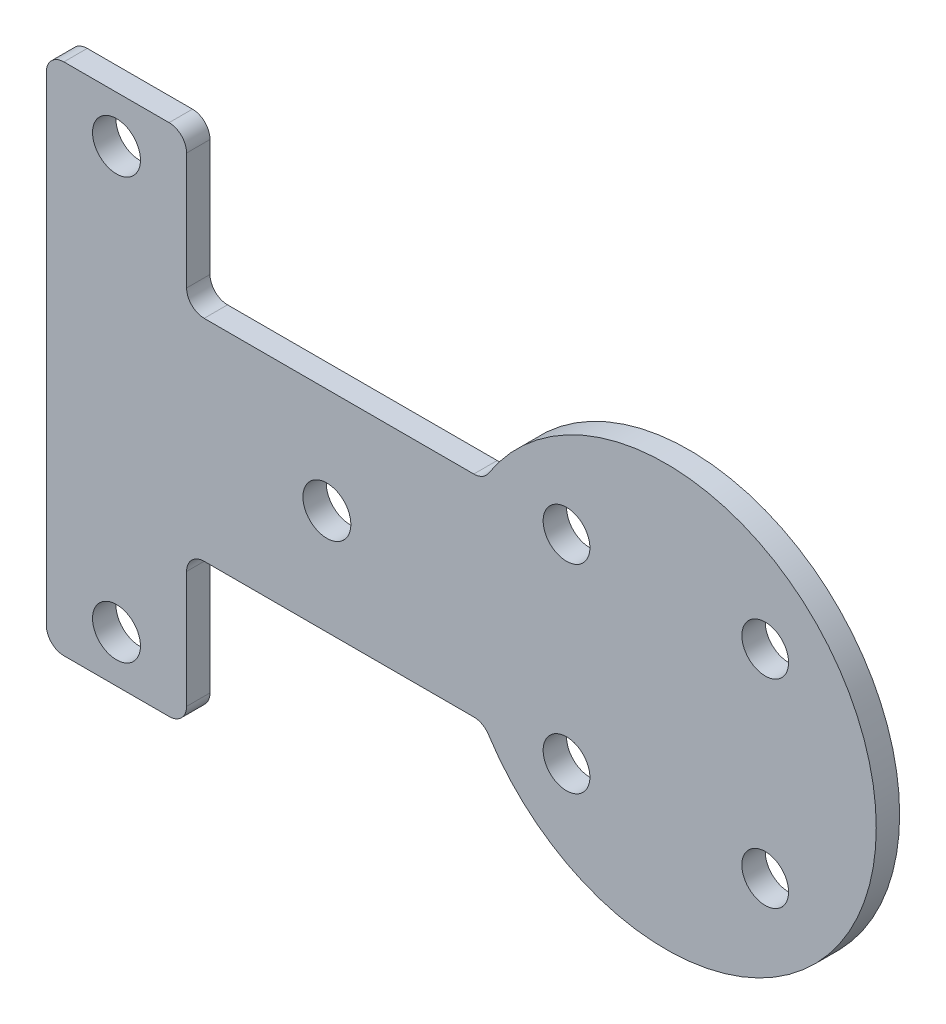
from build123d import *

# Parameters (mm, degrees)
SKETCH_1_R      = 2.05
SKETCH_1_R_2    = 2
EXTRUDE_1_DEPTH = 2
FILLET_1_R      = 1.5


with BuildPart() as part:
    # 草图1 → 凸台-拉伸1 (new body)
    with BuildSketch(Plane.XY):
        with BuildLine():
            Line((-42.723571429, -13.369911995), (-17.312028697, -13.369911995))
            ThreePointArc((-17.312028697, -13.369911995), (16.276428571, -4.369911995), (-17.312028697, 4.630088005))
            Line((-17.312028697, 4.630088005), (-42.723571429, 4.630088005))
            Line((-42.723571429, 4.630088005), (-42.723571429, 17.630088005))
            Line((-42.723571429, 17.630088005), (-54.723571429, 17.630088005))
            Line((-54.723571429, 17.630088005), (-54.723571429, -26.369911995))
            Line((-54.723571429, -26.369911995), (-42.723571429, -26.369911995))
            Line((-42.723571429, -26.369911995), (-42.723571429, -13.369911995))
        make_face()
        with Locations((-30.723571429, -4.369911995)):
            Circle(SKETCH_1_R, mode=Mode.SUBTRACT)
        with Locations((-48.723571429, 13.630088005)):
            Circle(SKETCH_1_R, mode=Mode.SUBTRACT)
        with Locations((-48.723571429, -22.369911995)):
            Circle(SKETCH_1_R, mode=Mode.SUBTRACT)
        with Locations((6.776428571, -12.869911995)):
            Circle(SKETCH_1_R_2, mode=Mode.SUBTRACT)
        with Locations((-10.223571429, -12.869911995)):
            Circle(SKETCH_1_R_2, mode=Mode.SUBTRACT)
        with Locations((-10.223571429, 4.130088005)):
            Circle(SKETCH_1_R_2, mode=Mode.SUBTRACT)
        with Locations((6.776428571, 4.130088005)):
            Circle(SKETCH_1_R_2, mode=Mode.SUBTRACT)
    extrude(amount=EXTRUDE_1_DEPTH)

    # 圆角1
    fillet_1_edges = [part.edges().sort_by_distance(p)[0] for p in [
        (-42.723571429, -13.369911995, 1),
        (-42.723571429, -26.369911995, 1),
        (-54.723571429, -26.369911995, 1),
        (-54.723571429, 17.630088005, 1),
        (-42.723571429, 17.630088005, 1),
        (-42.723571429, 4.630088005, 1),
        (-17.312028697, 4.630088005, 1),
        (-17.312028697, -13.369911995, 1),
    ]]
    fillet(fillet_1_edges, radius=FILLET_1_R)


solid = part.part
